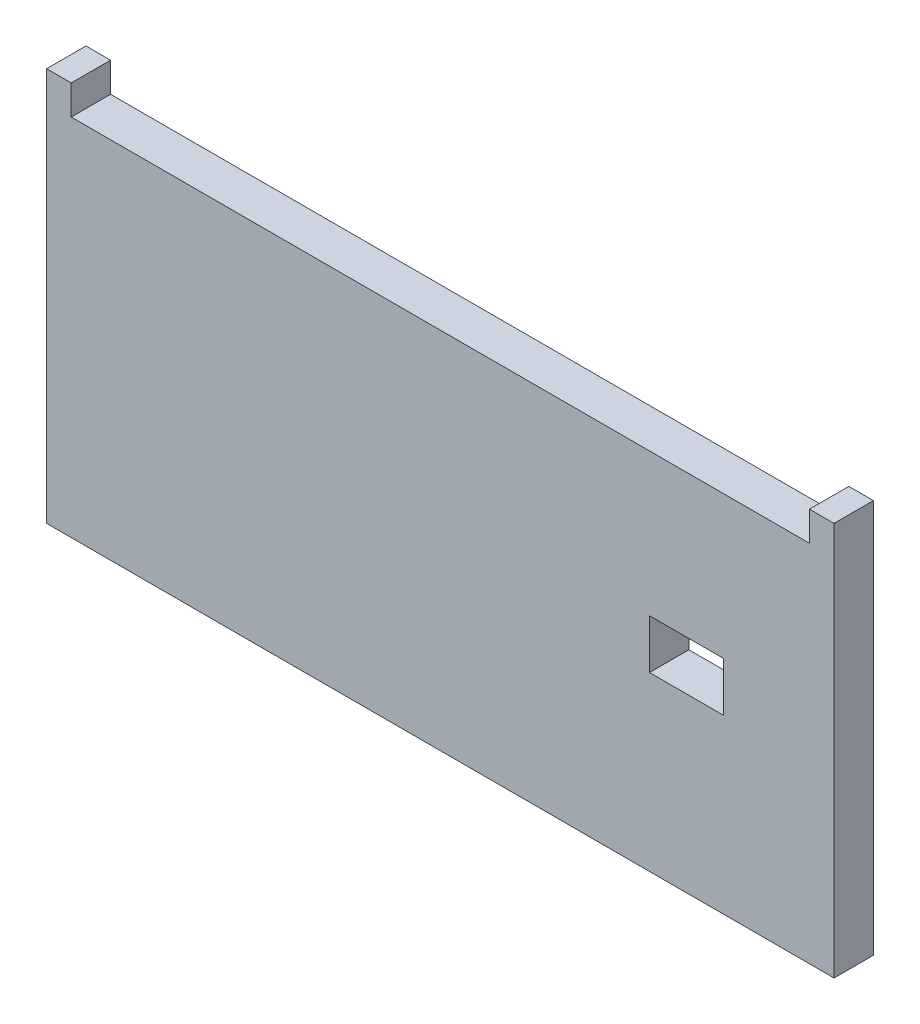
from build123d import *

# Parameters (mm, degrees)
SKETCH_1_W          = 160
SKETCH_1_H          = 80
EXTRUDE_1_DEPTH     = 8
SKETCH_2_W          = 150
SKETCH_2_H          = 75
CUT_EXTRUDE_1_DEPTH = 6
SKETCH_3_W          = 15
SKETCH_3_H          = 10
CUT_EXTRUDE_2_DEPTH = 90.799777283


with BuildPart() as part:
    # 草图1 → 凸台-拉伸1 (new body)
    with BuildSketch(Plane.XY):
        Rectangle(SKETCH_1_W, SKETCH_1_H)
    extrude(amount=EXTRUDE_1_DEPTH)

    # 草图2 → 切除-拉伸1 (cut)
    with BuildSketch(Plane(origin=(0, 40, 0), x_dir=(1, 0, 0), z_dir=(0, 1, 0))):
        Rectangle(SKETCH_2_W, SKETCH_2_H)
    extrude(amount=-CUT_EXTRUDE_1_DEPTH, mode=Mode.SUBTRACT)

    # 草图3 → 切除-拉伸2 (cut, through all)
    with BuildSketch(Plane.XY.offset(8)):
        with Locations((50, 0)):
            Rectangle(SKETCH_3_W, SKETCH_3_H)
    extrude(amount=-CUT_EXTRUDE_2_DEPTH, mode=Mode.SUBTRACT)


solid = part.part
